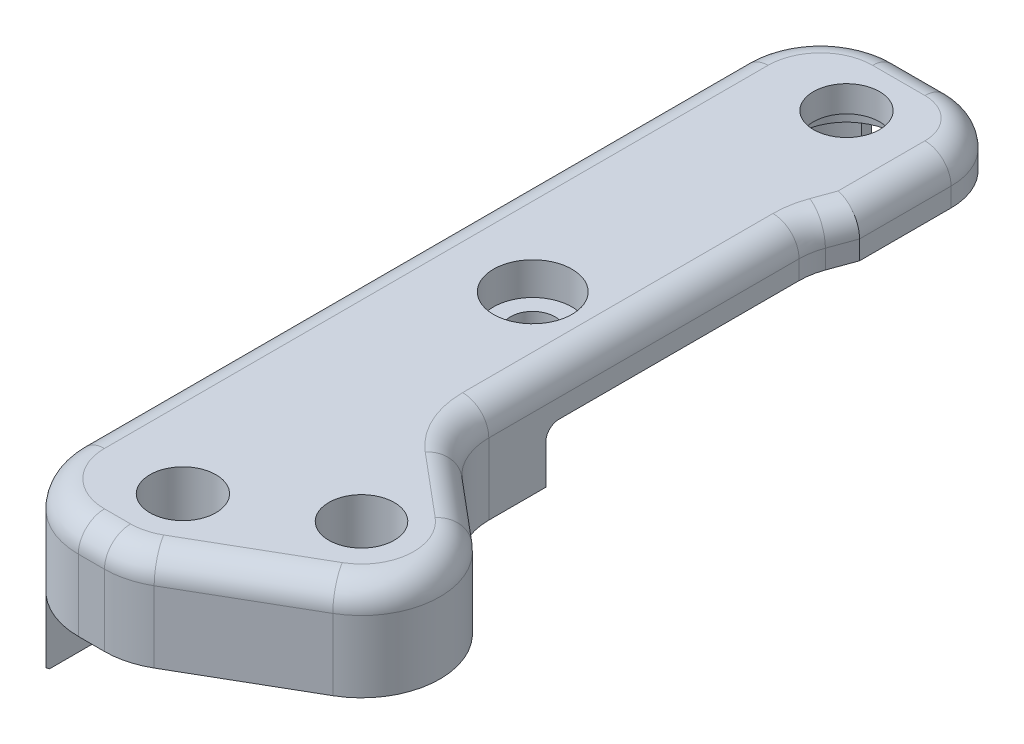
from build123d import *

# Parameters (mm, degrees)
EXTRUDE_1_DEPTH           = 7.45
EXTRUDE_2_DEPTH           = 3.45
SKETCH_3_W                = 35
SKETCH_3_H                = 4
CUT_EXTRUDE_1_DEPTH       = 9.8
SKETCH_4_W                = 4.2
SKETCH_4_H                = 62.754310162
EXTRUDE_3_DEPTH           = 5.05
CUT_EXTRUDE_2_DEPTH       = 1.45
SKETCH_6_W                = 7.8
SKETCH_6_H                = 4
EXTRUDE_4_DEPTH           = 5.05
CUT_EXTRUDE_3_REACH       = 67.367
SKETCH_8_W                = 5.05
SKETCH_8_H                = 12
SKETCH_9_W                = 14
SKETCH_9_H                = 5.05
CUT_EXTRUDE_4_DEPTH       = 2.2
CUT_EXTRUDE_5_DEPTH       = 9.05
HOLE_WIZARD_1_D           = 5.01
HOLE_WIZARD_2_D           = 5.05
HOLE_WIZARD_3_D           = 5.05
HOLE_WIZARD_4_D           = 3.4
HOLE_WIZARD_4_DEPTH       = 12.5
HOLE_WIZARD_4_CBORE_D     = 6
HOLE_WIZARD_4_CBORE_DEPTH = 2.5
FILLET_1_R                = 5
FILLET_2_R                = 6
CHAMFER_1_SIZE            = 0.2
FILLET_3_R                = 0.5
FILLET_4_R                = 1
FILLET_5_R                = 2


with BuildPart() as part:
    # 草图1 → 凸台-拉伸1 (new body)
    with BuildSketch(Plane.XZ.offset(-17.55)):
        with BuildLine():
            Line((-8, -56.754310162), (6, -56.754310162))
            Line((6, -56.754310162), (6, -15.064661918))
            Line((6, -15.064661918), (12.516979696, -9.596266659))
            ThreePointArc((12.516979696, -9.596266659), (14.637422226, -4.477065544), (11.660254038, 0.196152423))
            Line((11.660254038, 0.196152423), (1.607695155, 6))
            Line((1.607695155, 6), (-8, 6))
            Line((-8, 6), (-8, -56.754310162))
        make_face()
    extrude(amount=-EXTRUDE_1_DEPTH)

    # 草图2 → 凸台-拉伸2 (add)
    with BuildSketch(Plane(origin=(0, 25, 0), x_dir=(1, 0, 0), z_dir=(0, 1, 0))):
        Polygon((6, 56.754310162), (6, 42.006832742), (7, 44.754310162), (7, 56.754310162), align=None)
    extrude(amount=-EXTRUDE_2_DEPTH)

    # 草图3 → 切除-拉伸1 (cut)
    with BuildSketch(Plane(origin=(6, 0, 0), x_dir=(0, 0, -1), z_dir=(1, 0, 0))):
        with Locations((39.254310162, 19.55)):
            Rectangle(SKETCH_3_W, SKETCH_3_H)
    extrude(amount=-CUT_EXTRUDE_1_DEPTH, mode=Mode.SUBTRACT)

    # 草图4 → 凸台-拉伸3 (add)
    with BuildSketch(Plane.XZ.offset(-17.55)):
        with Locations((-5.9, -25.377155081)):
            Rectangle(SKETCH_4_W, SKETCH_4_H)
    extrude(amount=EXTRUDE_3_DEPTH)

    # 草图5 → 切除-拉伸2 (cut)
    with BuildSketch(Plane.XZ.offset(-21.55)):
        with BuildLine():
            Line((-2.5, -30.754310162), (-3.8, -30.754310162))
            Line((-3.8, -30.754310162), (-3.8, -50.754310162))
            ThreePointArc((-3.8, -50.754310162), (3.252405192, -52.719471851), (-1.76744186, -47.390361698))
            ThreePointArc((-1.76744186, -47.390361698), (-2.258573906, -47.375684951), (-2.5, -46.9477369))
            Line((-2.5, -46.9477369), (-2.5, -30.754310162))
        make_face()
    extrude(amount=-CUT_EXTRUDE_2_DEPTH, mode=Mode.SUBTRACT)

    # 草图6 → 凸台-拉伸4 (add)
    with BuildSketch(Plane.XZ.offset(-17.55)):
        with Locations((0.1, -10)):
            Rectangle(SKETCH_6_W, SKETCH_6_H)
    extrude(amount=EXTRUDE_4_DEPTH)

    # 草图8 → 切除-拉伸3 (cut, up to next)
    with BuildSketch(Plane(origin=(-6, 0, 0), x_dir=(0, -1, 0), z_dir=(-1, 0, 0)), mode=Mode.PRIVATE) as cut_extrude_3_sk1:
        with Locations((-15.025, -18)):
            Rectangle(SKETCH_8_W, SKETCH_8_H)
    cut_extrude_3_tool1 = extrude(cut_extrude_3_sk1.sketch, amount=-CUT_EXTRUDE_3_REACH, mode=Mode.PRIVATE) & part.part
    add(cut_extrude_3_tool1.solids().sort_by_distance((-6, 15.025, -18))[0], mode=Mode.SUBTRACT)

    # 草图9 → 切除-拉伸4 (cut)
    with BuildSketch(Plane(origin=(-3.8, 0, 0), x_dir=(0, 0, -1), z_dir=(1, 0, 0))):
        with Locations((1, 15.025)):
            Rectangle(SKETCH_9_W, SKETCH_9_H)
    extrude(amount=-CUT_EXTRUDE_4_DEPTH, mode=Mode.SUBTRACT)

    # 草图10 → 切除-拉伸5 (cut)
    with BuildSketch(Plane.XZ.offset(-12.5)):
        with BuildLine():
            Line((-3.8, -55.716416569), (-3.8, -45.792203754))
            ThreePointArc((-3.8, -45.792203754), (-6.25, -50.754310162), (-3.8, -55.716416569))
        make_face()
    extrude(amount=-CUT_EXTRUDE_5_DEPTH, mode=Mode.SUBTRACT)

    # 孔1 (through all)
    with Locations(Plane(origin=(0, 17.55, 0), x_dir=(-1, 0, 0), z_dir=(0, -1, 0))):
        with Locations((-8.660254038, 5)):
            Hole(HOLE_WIZARD_1_D / 2)

    # 孔2 (through all)
    with Locations(Plane(origin=(0, 17.55, 0), x_dir=(-1, 0, 0), z_dir=(0, -1, 0))):
        with Locations((0, 0)):
            Hole(HOLE_WIZARD_2_D / 2)

    # 孔3 (through all)
    with Locations(Plane(origin=(0, 23, 0), x_dir=(-1, 0, 0), z_dir=(0, -1, 0))):
        with Locations((0, 50.754310162)):
            Hole(HOLE_WIZARD_3_D / 2)

    # 孔4
    with Locations(Plane(origin=(0, 25, 0), x_dir=(1, 0, 0), z_dir=(0, 1, 0))):
        with Locations((0, 26.754310162)):
            CounterBoreHole(HOLE_WIZARD_4_D / 2, HOLE_WIZARD_4_CBORE_D / 2, HOLE_WIZARD_4_CBORE_DEPTH, depth=HOLE_WIZARD_4_DEPTH)

    # 圆角1
    fillet_1_edges = [part.edges().sort_by_distance(p)[0] for p in [
        (6, 21.275, -15.064661918),
        (7, 23.275, -56.754310162),
        (6, 23.275, -42.006832742),
    ]]
    fillet(fillet_1_edges, radius=FILLET_1_R)

    # 圆角2
    fillet_2_edges = [part.edges().sort_by_distance(p)[0] for p in [
        (-8, 18.75, -56.754310162),
        (-8, 18.75, 6),
        (1.607695155, 21.275, 6),
    ]]
    fillet(fillet_2_edges, radius=FILLET_2_R)

    # 倒角1
    chamfer_1_edges = [part.edges().sort_by_distance(p)[0] for p in [
        (-8, 12.5, -25.377155081),
        (-7.477225575, 12.5, 2.449489743),
        (-6.837354649, 12.5, -54.303958032),
    ]]
    chamfer(chamfer_1_edges, length=CHAMFER_1_SIZE)

    # 圆角3
    fillet_3_edges = [part.edges().sort_by_distance(p)[0] for p in [
        (-2.5, 22.275, -30.754310162),
        (-3.8, 22.275, -30.754310162),
    ]]
    fillet(fillet_3_edges, radius=FILLET_3_R)

    # 圆角4
    fillet_4_edges = [part.edges().sort_by_distance(p)[0] for p in [
        (1.1, 21.55, -21.754310162),
        (-1, 17.55, -8),
        (-1, 17.55, -12),
        (-4.9, 17.55, -24),
    ]]
    fillet(fillet_4_edges, radius=FILLET_4_R)

    # 圆角5
    fillet_5_edges = [part.edges().sort_by_distance(p)[0] for p in [
        (6, 25, -29.260699024),
        (6.650768448, 25, -43.794804359),
        (10.151520824, 25, -11.581122326),
        (5.535533906, 25, -55.289844068),
        (6.075961235, 25, -41.993438727),
        (6.468461065, 25, -15.2831089),
        (-8, 25, -25.377155081),
        (0, 25, -56.754310162),
        (-1, 25, 6),
        (1.552914271, 25, 5.795554958),
        (-6.242640687, 25, 4.242640687),
        (-6.242640687, 25, -54.996950849),
        (14.637422226, 25, -4.477065544),
        (7.330127019, 25, 2.696152423),
        (7, 25, -48.254310162),
    ]]
    fillet(fillet_5_edges, radius=FILLET_5_R)


solid = part.part
